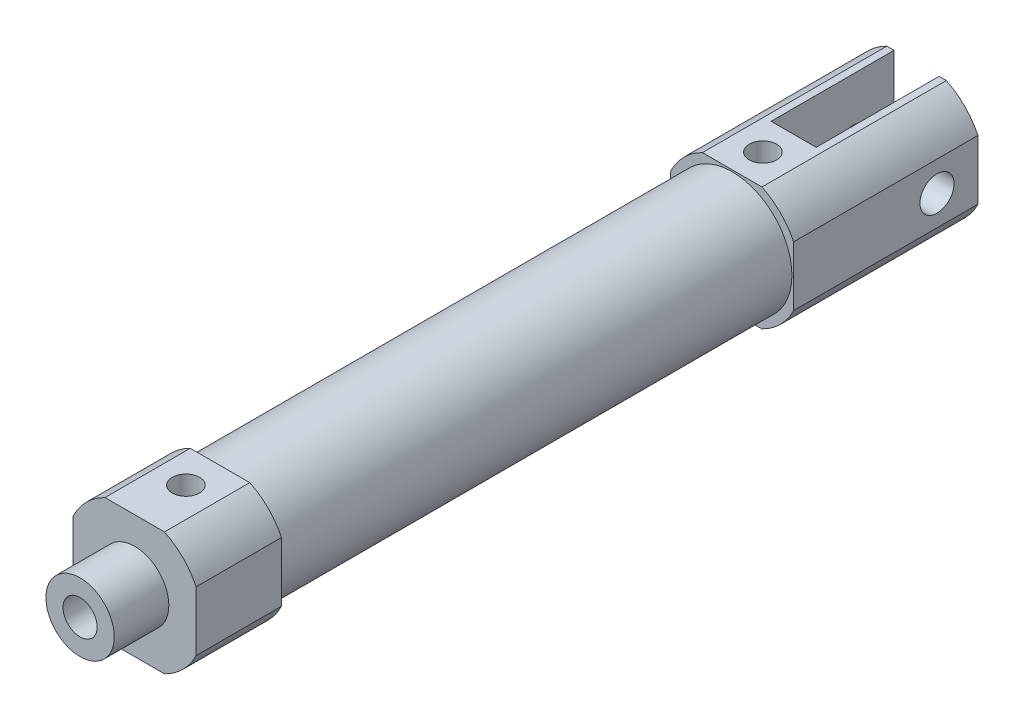
from build123d import *

# Parameters (mm, degrees)
BOSS_EXTRUDE1_DEPTH = 27
SKETCH2_R           = 8.75
BOSS_EXTRUDE2_DEPTH = 75
BOSS_EXTRUDE3_DEPTH = 12.5
SKETCH4_R           = 5
BOSS_EXTRUDE4_DEPTH = 8
SKETCH5_R           = 2.5
CUT_EXTRUDE1_DEPTH  = 50
SKETCH6_R           = 2
CUT_EXTRUDE2_DEPTH  = 4
CUT_EXTRUDE4_DEPTH  = 125.142055726
SKETCH10_R          = 2
CUT_EXTRUDE5_DEPTH  = 4
SKETCH11_R          = 2.5
CUT_EXTRUDE6_DEPTH  = 125.142055726


with BuildPart() as part:
    # Sketch1 → Boss-Extrude1 (new body)
    with BuildSketch(Plane.XY):
        with BuildLine():
            Line((-4.358898944, -9), (4.358898944, -9))
            ThreePointArc((4.358898944, -9), (7.071067812, -7.071067812), (9, -4.358898944))
            Line((9, -4.358898944), (9, 4.358898944))
            ThreePointArc((9, 4.358898944), (7.071067812, 7.071067812), (4.358898944, 9))
            Line((4.358898944, 9), (-4.358898944, 9))
            ThreePointArc((-4.358898944, 9), (-7.071067812, 7.071067812), (-9, 4.358898944))
            Line((-9, 4.358898944), (-9, -4.358898944))
            ThreePointArc((-9, -4.358898944), (-7.071067812, -7.071067812), (-4.358898944, -9))
        make_face()
    extrude(amount=BOSS_EXTRUDE1_DEPTH)

    # Sketch2 → Boss-Extrude2 (add)
    with BuildSketch(Plane.XY.offset(27)):
        Circle(SKETCH2_R)
    extrude(amount=BOSS_EXTRUDE2_DEPTH)

    # Sketch3 → Boss-Extrude3 (add)
    with BuildSketch(Plane.XY.offset(102)):
        with BuildLine():
            Line((-4.358898944, -9), (4.358898944, -9))
            ThreePointArc((4.358898944, -9), (7.071067812, -7.071067812), (9, -4.358898944))
            Line((9, -4.358898944), (9, 4.358898944))
            ThreePointArc((9, 4.358898944), (7.071067812, 7.071067812), (4.358898944, 9))
            Line((4.358898944, 9), (-4.358898944, 9))
            ThreePointArc((-4.358898944, 9), (-7.071067812, 7.071067812), (-9, 4.358898944))
            Line((-9, 4.358898944), (-9, -4.358898944))
            ThreePointArc((-9, -4.358898944), (-7.071067812, -7.071067812), (-4.358898944, -9))
        make_face()
    extrude(amount=BOSS_EXTRUDE3_DEPTH)

    # Sketch4 → Boss-Extrude4 (add)
    with BuildSketch(Plane.XY.offset(114.5)):
        Circle(SKETCH4_R)
    extrude(amount=BOSS_EXTRUDE4_DEPTH)

    # Sketch5 → Cut-Extrude1 (cut)
    with BuildSketch(Plane.XY.offset(122.5)):
        Circle(SKETCH5_R)
    extrude(amount=-CUT_EXTRUDE1_DEPTH, mode=Mode.SUBTRACT)

    # Sketch6 → Cut-Extrude2 (cut)
    with BuildSketch(Plane(origin=(0, 9, 0), x_dir=(1, 0, 0), z_dir=(0, 1, 0))):
        with Locations(Location((0, -107, 0), (0, 0, 270))):
            Circle(SKETCH6_R)
    extrude(amount=-CUT_EXTRUDE2_DEPTH, mode=Mode.SUBTRACT)

    # Sketch9 → Cut-Extrude4 (cut, through all)
    with BuildSketch(Plane(origin=(0, 9, 0), x_dir=(1, 0, 0), z_dir=(0, 1, 0))):
        Polygon((3.3, 0), (0, 0), (-3.3, 0), (-3.3, -18), (3.3, -18), align=None)
    extrude(amount=-CUT_EXTRUDE4_DEPTH, mode=Mode.SUBTRACT)

    # Sketch10 → Cut-Extrude5 (cut)
    with BuildSketch(Plane(origin=(0, 9, 0), x_dir=(1, 0, 0), z_dir=(0, 1, 0))):
        with Locations(Location((0, -22.5, 0), (0, 0, 180))):
            Circle(SKETCH10_R)
    extrude(amount=-CUT_EXTRUDE5_DEPTH, mode=Mode.SUBTRACT)

    # Sketch11 → Cut-Extrude6 (cut, through all)
    with BuildSketch(Plane.ZY.offset(9)):
        with Locations((6, 0)):
            Circle(SKETCH11_R)
    extrude(amount=-CUT_EXTRUDE6_DEPTH, mode=Mode.SUBTRACT)


solid = part.part
